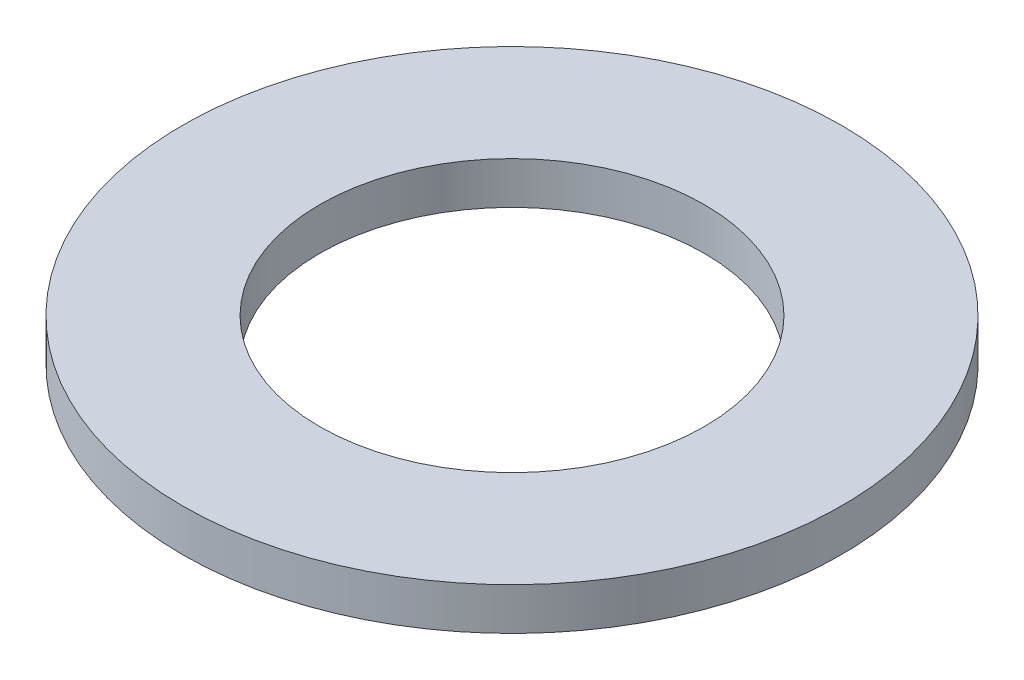
from build123d import *

# Parameters (mm, degrees)
SKETCH1_R           = 49.53
SKETCH1_R_2         = 28.9052
BOSS_EXTRUDE1_DEPTH = 6.35


with BuildPart() as part:
    # Sketch1 → Boss-Extrude1 (new body)
    with BuildSketch(Plane(origin=(0, 0, 0), x_dir=(1, 0, 0), z_dir=(0, 1, 0))):
        with Locations(Location((0, 0, 0), (0, 0, 270))):
            Circle(SKETCH1_R)
        with Locations(Location((0, 0, 0), (0, 0, 270))):
            Circle(SKETCH1_R_2, mode=Mode.SUBTRACT)
    extrude(amount=BOSS_EXTRUDE1_DEPTH)


solid = part.part
